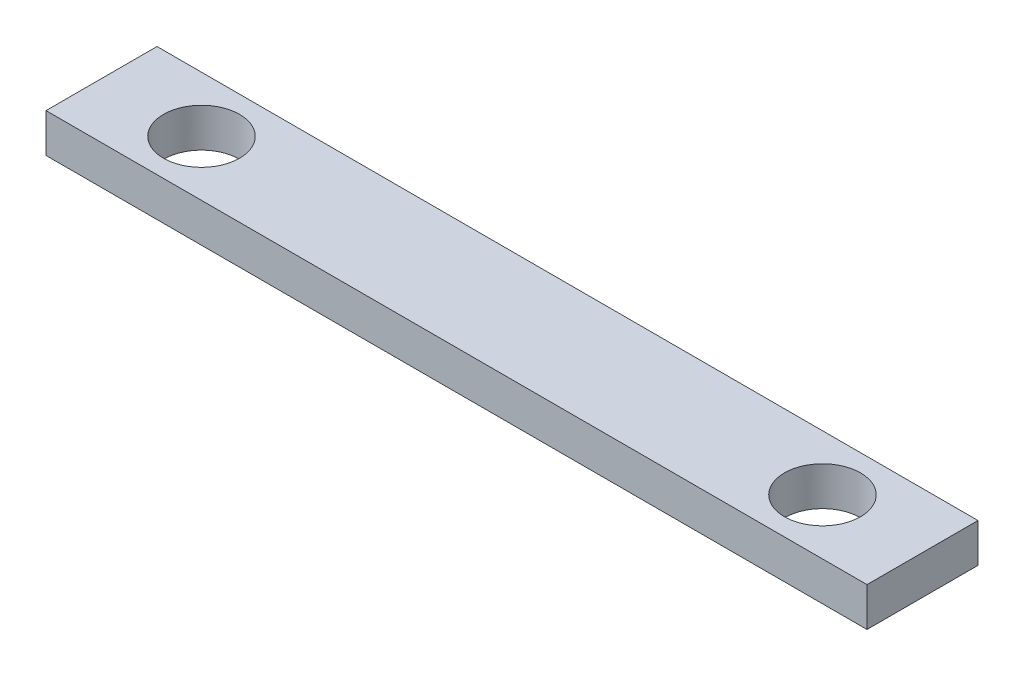
from build123d import *

# Parameters (mm, degrees)
BOSS_EXTRUDE1_DEPTH = 25.654
SKETCH2_W           = 20.6502
SKETCH2_H           = 12.3952
CUT_EXTRUDE1_DEPTH  = 63.010623853
SKETCH3_W           = 42.037
SKETCH3_H           = 20.6502
CUT_EXTRUDE2_DEPTH  = 62.078275718
CUT_EXTRUDE3_DEPTH  = 5.08
SKETCH5_R           = 1.0795
CUT_EXTRUDE4_DEPTH  = 62.078275718
SKETCH6_R           = 1.7145
CUT_EXTRUDE5_DEPTH  = 63.010623853
SKETCH7_W           = 13.199565881
SKETCH7_H           = 28.375595839
SKETCH7_W_2         = 9.485915606
CUT_EXTRUDE6_DEPTH  = 63.010623853
SKETCH8_W           = 38.481
SKETCH8_H           = 14.6304
CUT_EXTRUDE7_DEPTH  = 59.330512418
SKETCH9_W           = 1.4732
SKETCH9_H           = 5.0038
CUT_EXTRUDE8_DEPTH  = 2.54


with BuildPart() as part:
    # Sketch1 → Boss-Extrude1 (new body)
    with BuildSketch(Plane.XY):
        with BuildLine():
            Line((0, 0), (54.0258, 0))
            Line((54.0258, 0), (54.0258, 3.9878))
            Line((54.0258, 3.9878), (51.176616962, 11.038320738))
            ThreePointArc((51.176616962, 11.038320738), (51.065947457, 11.411860999), (51.0286, 11.799656349))
            Line((51.0286, 11.799656349), (51.0286, 15.113))
            Line((51.0286, 15.113), (49.7586, 16.383))
            Line((49.7586, 16.383), (11.2776, 16.383))
            Line((11.2776, 16.383), (10.0076, 15.113))
            Line((10.0076, 15.113), (10.0076, 12.427861529))
            ThreePointArc((10.0076, 12.427861529), (9.790474401, 11.513938717), (9.185498713, 10.795326965))
            Line((9.185498713, 10.795326965), (0, 3.9878))
            Line((0, 3.9878), (0, 0))
        make_face()
    extrude(amount=-BOSS_EXTRUDE1_DEPTH)

    # Sketch2 → Cut-Extrude1 (cut, through all)
    with BuildSketch(Plane(origin=(54.0258, 0, 0), x_dir=(0, 0, -1), z_dir=(1, 0, 0))):
        with Locations((15.3289, 10.1854)):
            Rectangle(SKETCH2_W, SKETCH2_H)
    extrude(amount=-CUT_EXTRUDE1_DEPTH, mode=Mode.SUBTRACT)

    # Sketch3 → Cut-Extrude2 (cut, through all)
    with BuildSketch(Plane(origin=(0, 3.9878, 0), x_dir=(1, 0, 0), z_dir=(0, 1, 0))):
        with Locations((27.0129, 15.3289)):
            Rectangle(SKETCH3_W, SKETCH3_H)
    extrude(amount=-CUT_EXTRUDE2_DEPTH, mode=Mode.SUBTRACT)

    # Sketch4 → Cut-Extrude3 (cut)
    with BuildSketch(Plane.XY):
        with BuildLine():
            Line((6.901956547, 3.937), (10.414, 3.937))
            ThreePointArc((10.414, 3.937), (11.473670222, 4.375929778), (11.9126, 5.4356))
            Line((11.9126, 5.4356), (11.9126, 8.038434234))
            ThreePointArc((11.9126, 8.038434234), (11.088018074, 9.376904105), (9.521699699, 9.242428475))
            Line((9.521699699, 9.242428475), (6.009656246, 6.639594241))
            ThreePointArc((6.009656246, 6.639594241), (5.478912674, 4.965761629), (6.901956547, 3.937))
        make_face()
        with BuildLine():
            Line((47.752, 13.9446), (42.6212, 13.9446))
            ThreePointArc((42.6212, 13.9446), (41.561529778, 13.505670222), (41.1226, 12.446))
            Line((41.1226, 12.446), (41.1226, 5.4356))
            ThreePointArc((41.1226, 5.4356), (41.561529778, 4.375929778), (42.6212, 3.937))
            Line((42.6212, 3.937), (47.752, 3.937))
            ThreePointArc((47.752, 3.937), (48.811670222, 4.375929778), (49.2506, 5.4356))
            Line((49.2506, 5.4356), (49.2506, 12.446))
            ThreePointArc((49.2506, 12.446), (48.811670222, 13.505670222), (47.752, 13.9446))
        make_face()
        with BuildLine():
            Line((13.3096, 12.446), (13.3096, 5.4356))
            ThreePointArc((13.3096, 5.4356), (13.748529778, 4.375929778), (14.8082, 3.937))
            Line((14.8082, 3.937), (19.939, 3.937))
            ThreePointArc((19.939, 3.937), (20.998670222, 4.375929778), (21.4376, 5.4356))
            Line((21.4376, 5.4356), (21.4376, 12.446))
            ThreePointArc((21.4376, 12.446), (20.998670222, 13.505670222), (19.939, 13.9446))
            Line((19.939, 13.9446), (14.8082, 13.9446))
            ThreePointArc((14.8082, 13.9446), (13.748529778, 13.505670222), (13.3096, 12.446))
        make_face()
        with BuildLine():
            Line((22.8346, 12.446), (22.8346, 5.4356))
            ThreePointArc((22.8346, 5.4356), (23.273529778, 4.375929778), (24.3332, 3.937))
            Line((24.3332, 3.937), (38.227, 3.937))
            ThreePointArc((38.227, 3.937), (39.286670222, 4.375929778), (39.7256, 5.4356))
            Line((39.7256, 5.4356), (39.7256, 12.446))
            ThreePointArc((39.7256, 12.446), (39.286670222, 13.505670222), (38.227, 13.9446))
            Line((38.227, 13.9446), (24.3332, 13.9446))
            ThreePointArc((24.3332, 13.9446), (23.273529778, 13.505670222), (22.8346, 12.446))
        make_face()
    extrude(amount=-CUT_EXTRUDE3_DEPTH, mode=Mode.SUBTRACT)

    # Sketch5 → Cut-Extrude4 (cut, through all)
    with BuildSketch(Plane(origin=(0, 3.9878, 0), x_dir=(1, 0, 0), z_dir=(0, 1, 0))):
        with Locations(Location((51.0286, 21.336, 0), (0, 0, 270))):
            Circle(SKETCH5_R)
        with Locations(Location((51.0286, 11.3538, 0), (0, 0, 270))):
            Circle(SKETCH5_R)
        with Locations(Location((2.9972, 11.3538, 0), (0, 0, 90))):
            Circle(SKETCH5_R)
        with Locations(Location((2.9972, 21.336, 0), (0, 0, 90))):
            Circle(SKETCH5_R)
    extrude(amount=-CUT_EXTRUDE4_DEPTH, mode=Mode.SUBTRACT)

    # Sketch6 → Cut-Extrude5 (cut, through all)
    with BuildSketch(Plane.XZ):
        with Locations(Location((45.2501, -2.5019, 0), (0, 0, 270))):
            Circle(SKETCH6_R)
        with Locations(Location((17.2593, -2.5019, 0), (0, 0, 270))):
            Circle(SKETCH6_R)
    extrude(amount=-CUT_EXTRUDE5_DEPTH, mode=Mode.SUBTRACT)

    # Sketch7 → Cut-Extrude6 (cut, through all)
    with BuildSketch(Plane(origin=(0, 16.383, 0), x_dir=(1, 0, 0), z_dir=(0, 1, 0))):
        with Locations((4.67781706, 13.121352654)):
            Rectangle(SKETCH7_W, SKETCH7_H)
        with Locations((54.501557803, 13.121352654)):
            Rectangle(SKETCH7_W_2, SKETCH7_H)
    extrude(amount=-CUT_EXTRUDE6_DEPTH, mode=Mode.SUBTRACT)

    # Sketch8 → Cut-Extrude7 (cut, through all)
    with BuildSketch(Plane.XY):
        with Locations((30.5181, 7.3152)):
            Rectangle(SKETCH8_W, SKETCH8_H)
    extrude(amount=-CUT_EXTRUDE7_DEPTH, mode=Mode.SUBTRACT)

    # Sketch9 → Cut-Extrude8 (cut)
    with BuildSketch(Plane(origin=(0, 16.383, 0), x_dir=(1, 0, 0), z_dir=(0, 1, 0))):
        with Locations((12.0142, 2.5019)):
            Rectangle(SKETCH9_W, SKETCH9_H)
    extrude(amount=-CUT_EXTRUDE8_DEPTH, mode=Mode.SUBTRACT)


solid = part.part
